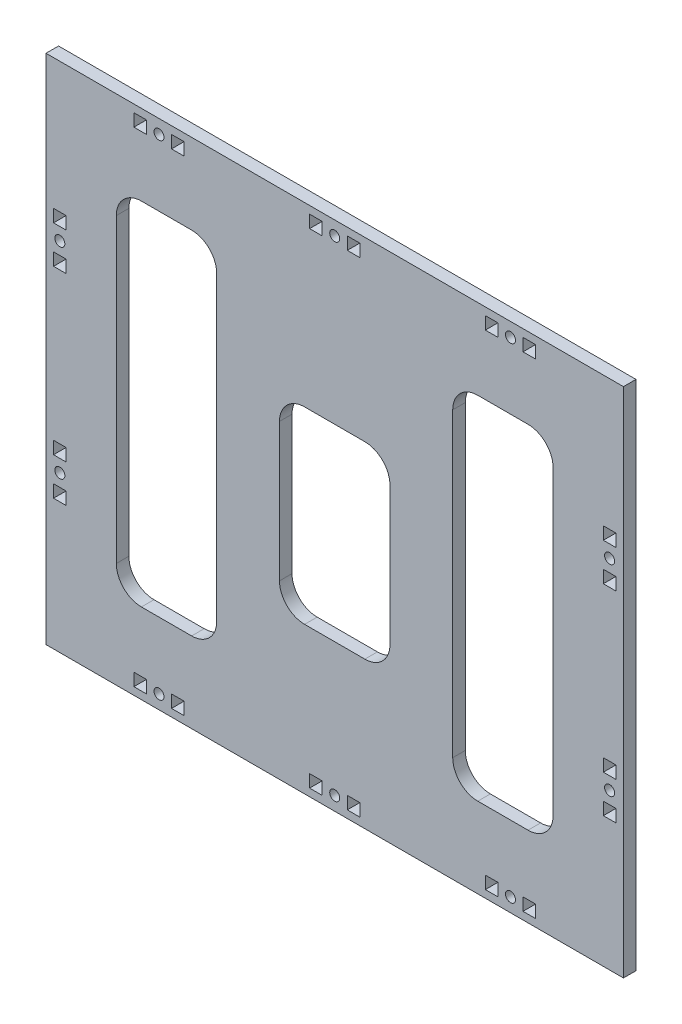
from build123d import *

# Parameters (mm, degrees)
ESQUISSE1_W        = 5
ESQUISSE1_H        = 5
ESQUISSE1_R        = 2
ESQUISSE1_W_2      = 40
ESQUISSE1_H_2      = 140
BOSS_EXTRU_1_DEPTH = 5
CONG_1_R           = 10


with BuildPart() as part:
    # Esquisse1 → Boss.-Extru.1 (new body)
    with BuildSketch(Plane.XY):
        Polygon((-182, 196), (-182, 188), (-182, 0), (-182, -8), (48, -8), (48, 0), (48, 188), (48, 196), align=None)
        with Locations((-144.5, -2.5)):
            Rectangle(ESQUISSE1_W, ESQUISSE1_H, mode=Mode.SUBTRACT)
        with Locations((-137, -2.5)):
            Circle(ESQUISSE1_R, mode=Mode.SUBTRACT)
        with Locations((-129.5, -2.5)):
            Rectangle(ESQUISSE1_W, ESQUISSE1_H, mode=Mode.SUBTRACT)
        with Locations((-74.5, -2.5)):
            Rectangle(ESQUISSE1_W, ESQUISSE1_H, mode=Mode.SUBTRACT)
        with Locations((-67, -2.5)):
            Circle(ESQUISSE1_R, mode=Mode.SUBTRACT)
        with Locations((-59.5, -2.5)):
            Rectangle(ESQUISSE1_W, ESQUISSE1_H, mode=Mode.SUBTRACT)
        with Locations((-4.5, -2.5)):
            Rectangle(ESQUISSE1_W, ESQUISSE1_H, mode=Mode.SUBTRACT)
        with Locations((3, -2.5)):
            Circle(ESQUISSE1_R, mode=Mode.SUBTRACT)
        with Locations((10.5, -2.5)):
            Rectangle(ESQUISSE1_W, ESQUISSE1_H, mode=Mode.SUBTRACT)
        with Locations((-176.5, 46.5)):
            Rectangle(ESQUISSE1_W, ESQUISSE1_H, mode=Mode.SUBTRACT)
        with Locations((-176.5, 54)):
            Circle(ESQUISSE1_R, mode=Mode.SUBTRACT)
        with Locations((-176.5, 61.5)):
            Rectangle(ESQUISSE1_W, ESQUISSE1_H, mode=Mode.SUBTRACT)
        with Locations((-134, 94)):
            Rectangle(ESQUISSE1_W_2, ESQUISSE1_H_2, mode=Mode.SUBTRACT)
        with Locations((-176.5, 126.5)):
            Rectangle(ESQUISSE1_W, ESQUISSE1_H, mode=Mode.SUBTRACT)
        with Locations((-176.5, 134)):
            Circle(ESQUISSE1_R, mode=Mode.SUBTRACT)
        with Locations((-176.5, 141.5)):
            Rectangle(ESQUISSE1_W, ESQUISSE1_H, mode=Mode.SUBTRACT)
        with Locations((-144.5, 190.5)):
            Rectangle(ESQUISSE1_W, ESQUISSE1_H, mode=Mode.SUBTRACT)
        with Locations((-137, 190.5)):
            Circle(ESQUISSE1_R, mode=Mode.SUBTRACT)
        with Locations((-129.5, 190.5)):
            Rectangle(ESQUISSE1_W, ESQUISSE1_H, mode=Mode.SUBTRACT)
        with Locations((-74.5, 190.5)):
            Rectangle(ESQUISSE1_W, ESQUISSE1_H, mode=Mode.SUBTRACT)
        Polygon((-89, 125.5), (-45, 125.5), (-45, 50.5), (-67, 50.5), (-89, 50.5), align=None, mode=Mode.SUBTRACT)
        with Locations((42.5, 46.5)):
            Rectangle(ESQUISSE1_W, ESQUISSE1_H, mode=Mode.SUBTRACT)
        with Locations((0, 94)):
            Rectangle(ESQUISSE1_W_2, ESQUISSE1_H_2, mode=Mode.SUBTRACT)
        with Locations((42.5, 54)):
            Circle(ESQUISSE1_R, mode=Mode.SUBTRACT)
        with Locations((42.5, 61.5)):
            Rectangle(ESQUISSE1_W, ESQUISSE1_H, mode=Mode.SUBTRACT)
        with Locations((-67, 190.5)):
            Circle(ESQUISSE1_R, mode=Mode.SUBTRACT)
        with Locations((-59.5, 190.5)):
            Rectangle(ESQUISSE1_W, ESQUISSE1_H, mode=Mode.SUBTRACT)
        with Locations((42.5, 126.5)):
            Rectangle(ESQUISSE1_W, ESQUISSE1_H, mode=Mode.SUBTRACT)
        with Locations((42.5, 134)):
            Circle(ESQUISSE1_R, mode=Mode.SUBTRACT)
        with Locations((42.5, 141.5)):
            Rectangle(ESQUISSE1_W, ESQUISSE1_H, mode=Mode.SUBTRACT)
        with Locations((-4.5, 190.5)):
            Rectangle(ESQUISSE1_W, ESQUISSE1_H, mode=Mode.SUBTRACT)
        with Locations((3, 190.5)):
            Circle(ESQUISSE1_R, mode=Mode.SUBTRACT)
        with Locations((10.5, 190.5)):
            Rectangle(ESQUISSE1_W, ESQUISSE1_H, mode=Mode.SUBTRACT)
    extrude(amount=BOSS_EXTRU_1_DEPTH)

    # Congé1
    cong_1_edges = [part.edges().sort_by_distance(p)[0] for p in [
        (-154, 24, 2.5),
        (-114, 24, 2.5),
        (-114, 164, 2.5),
        (-154, 164, 2.5),
        (-20, 164, 2.5),
        (-20, 24, 2.5),
        (20, 24, 2.5),
        (20, 164, 2.5),
        (-45, 125.5, 2.5),
        (-89, 125.5, 2.5),
        (-89, 50.5, 2.5),
        (-45, 50.5, 2.5),
    ]]
    fillet(cong_1_edges, radius=CONG_1_R)


solid = part.part
